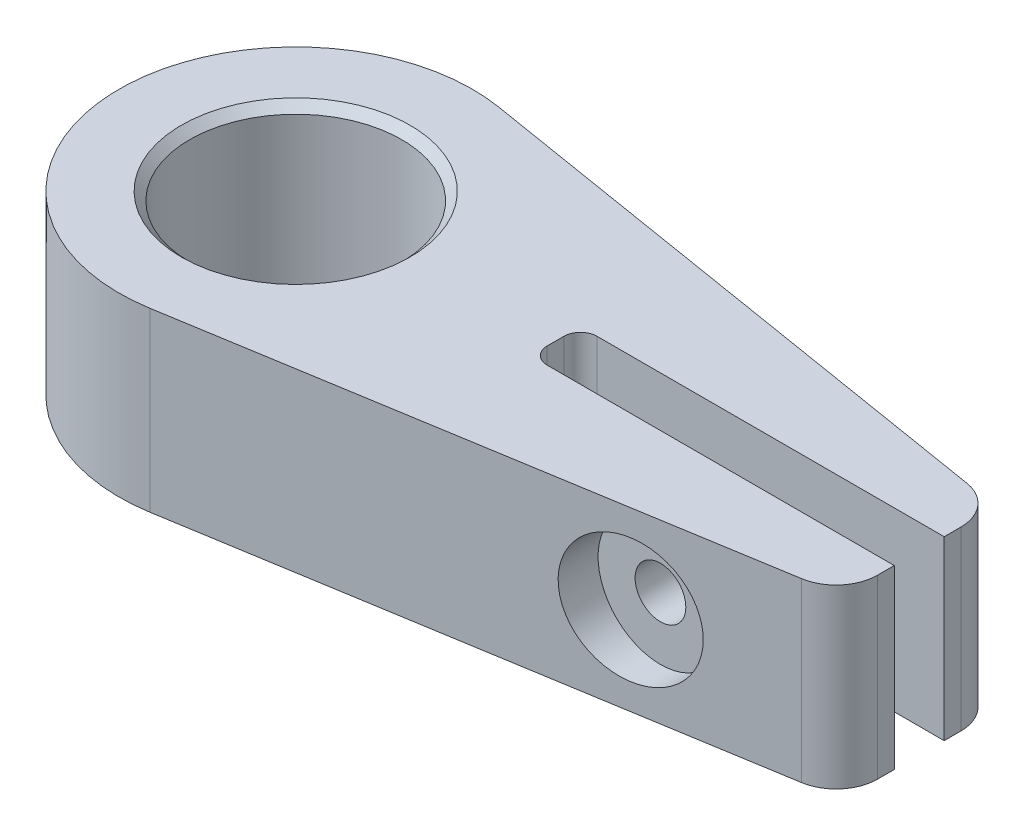
from build123d import *

# Parameters (mm, degrees)
SKETCH1_R               = 6.477
BOSS_EXTRUDE1_DEPTH     = 10.795
CUT_EXTRUDE3_DEPTH      = 64.211808035
CUT_EXTRUDE3_DEPTH_BACK = 64.211808035
SKETCH8_R               = 1.55
SKETCH9_R               = 3.81
CUT_EXTRUDE4_DEPTH      = 64.211808035
CUT_EXTRUDE5_DEPTH      = 64.211808035
FILLET1_R               = 1.016
SKETCH13_W              = 22.225
SKETCH13_H              = 9.4
CUT_EXTRUDE6_DEPTH      = 63.22676012
FILLET7_R               = 2.54
CHAMFER2_SIZE           = 0.508


with BuildPart() as part:
    # Sketch1 → Boss-Extrude1 (new body)
    with BuildSketch(Plane(origin=(0, 0, 0), x_dir=(1, 0, 0), z_dir=(0, 1, 0))):
        with BuildLine():
            Line((1.744418558, 10.653122964), (38.1, 4.7))
            Line((38.1, 4.7), (60.325, 4.7))
            Line((60.325, 4.7), (60.325, 1.525))
            Line((60.325, 1.525), (15.875, 1.525))
            Line((15.875, 1.525), (15.875, -1.525))
            Line((15.875, -1.525), (60.325, -1.525))
            Line((60.325, -1.525), (60.325, -4.7))
            Line((60.325, -4.7), (38.1, -4.7))
            Line((38.1, -4.7), (1.744418558, -10.653122964))
            ThreePointArc((1.744418558, -10.653122964), (-10.795, 0), (1.744418558, 10.653122964))
        make_face()
        with Locations(Location((0, 0, 0), (0, 0, 270))):
            Circle(SKETCH1_R, mode=Mode.SUBTRACT)
    extrude(amount=BOSS_EXTRUDE1_DEPTH)

    # Sketch8 → Cut-Extrude3 (cut, two sides: drawn at the far end of the back side and taken through both)
    with BuildSketch(Plane.XY.offset(4.7).offset(-CUT_EXTRUDE3_DEPTH_BACK)):
        with Locations((26.9875, 5.3975)):
            Circle(SKETCH8_R)
        with Locations((49.2125, 5.3975)):
            Circle(SKETCH8_R)
    extrude(amount=CUT_EXTRUDE3_DEPTH + CUT_EXTRUDE3_DEPTH_BACK, mode=Mode.SUBTRACT)

    # Sketch9 → Cut-Extrude4 (cut, through all)
    with BuildSketch(Plane.XY.offset(4.7)):
        with Locations((26.9875, 5.3975)):
            Circle(SKETCH9_R)
    extrude(amount=CUT_EXTRUDE4_DEPTH, mode=Mode.SUBTRACT)

    # Sketch10 → Cut-Extrude5 (cut, through all)
    with BuildSketch(Plane(origin=(0, 0, -4.7), x_dir=(-1, 0, 0), z_dir=(0, 0, -1))):
        Polygon((-24.13, 3.747721606), (-24.13, 7.047278394), (-26.9875, 8.697056788), (-29.845, 7.047278394), (-29.845, 3.747721606), (-26.9875, 2.097943212), align=None)
    extrude(amount=CUT_EXTRUDE5_DEPTH, mode=Mode.SUBTRACT)

    # Fillet1
    fillet1_edges = [part.edges().sort_by_distance(p)[0] for p in [
        (15.875, 5.3975, -1.525),
        (15.875, 5.3975, 1.525),
    ]]
    fillet(fillet1_edges, radius=FILLET1_R)

    # Sketch13 → Cut-Extrude6 (cut, through all)
    with BuildSketch(Plane.XZ):
        with Locations((49.2125, 0)):
            Rectangle(SKETCH13_W, SKETCH13_H)
    extrude(amount=-CUT_EXTRUDE6_DEPTH, mode=Mode.SUBTRACT)

    # Fillet7
    fillet7_edges = [part.edges().sort_by_distance(p)[0] for p in [
        (38.1, 5.3975, -4.7),
        (38.1, 5.3975, 4.7),
    ]]
    fillet(fillet7_edges, radius=FILLET7_R)

    # Chamfer2
    chamfer2_edges = [part.edges().sort_by_distance(p)[0] for p in [
        (0, 0, -6.477),
        (0, 10.795, -6.477),
    ]]
    chamfer(chamfer2_edges, length=CHAMFER2_SIZE)


solid = part.part
